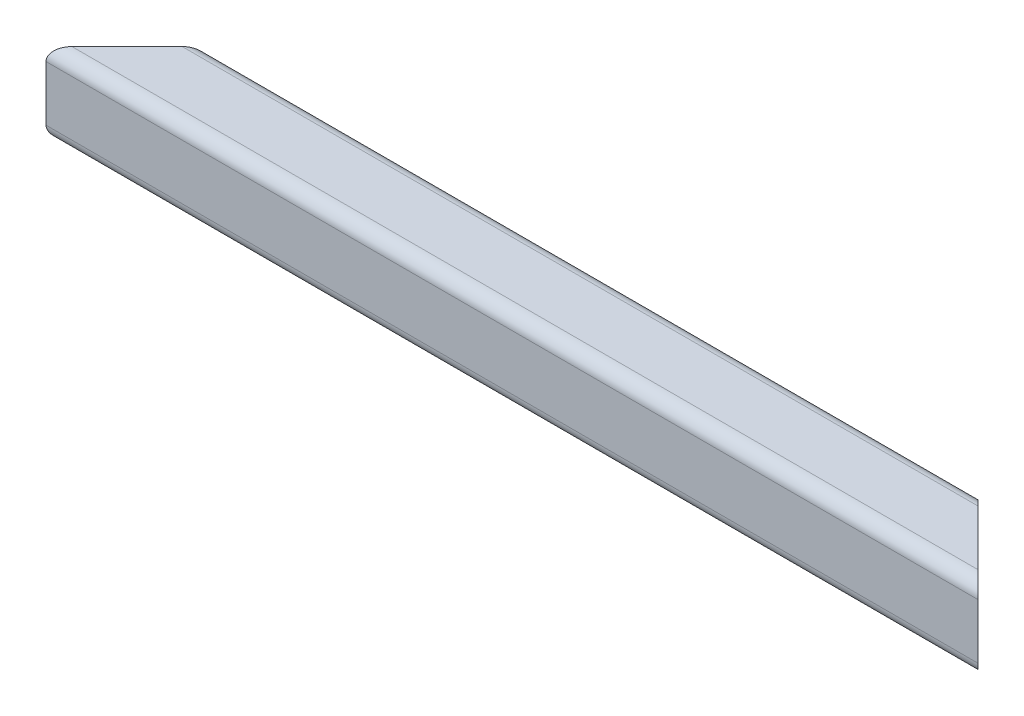
from build123d import *

# Parameters (mm, degrees)
TUBE_SQUARE_40_X_40_X_3_2_9_DEPTH = 460
CUT_EXTRUDE1_DEPTH                = 463.168800332
SKETCH15_R                        = 2
CUT_EXTRUDE4_DEPTH                = 461.868744872


with BuildPart() as part:
    # Sketch12 → Tube (square) 40 X 40 X 3.2(9) (new body)
    with BuildSketch(Plane(origin=(0, 0, 0), x_dir=(0, 0, -1), z_dir=(1, 0, 0))):
        with BuildLine():
            Line((-13.6, -20), (13.6, -20))
            ThreePointArc((13.6, -20), (18.1254834, -18.1254834), (20, -13.6))
            Line((20, -13.6), (20, 13.6))
            ThreePointArc((20, 13.6), (18.1254834, 18.1254834), (13.6, 20))
            Line((13.6, 20), (-13.6, 20))
            ThreePointArc((-13.6, 20), (-18.1254834, 18.1254834), (-20, 13.6))
            Line((-20, 13.6), (-20, -13.6))
            ThreePointArc((-20, -13.6), (-18.1254834, -18.1254834), (-13.6, -20))
        make_face()
        with BuildLine():
            Line((-13.6, -16.8), (13.6, -16.8))
            ThreePointArc((13.6, -16.8), (15.8627417, -15.8627417), (16.8, -13.6))
            Line((16.8, -13.6), (16.8, 13.6))
            ThreePointArc((16.8, 13.6), (15.8627417, 15.8627417), (13.6, 16.8))
            Line((13.6, 16.8), (-13.6, 16.8))
            ThreePointArc((-13.6, 16.8), (-15.8627417, 15.8627417), (-16.8, 13.6))
            Line((-16.8, 13.6), (-16.8, -13.6))
            ThreePointArc((-16.8, -13.6), (-15.8627417, -15.8627417), (-13.6, -16.8))
        make_face(mode=Mode.SUBTRACT)
    extrude(amount=TUBE_SQUARE_40_X_40_X_3_2_9_DEPTH)

    # Sketch13 → Cut-Extrude1 (cut, through all)
    with BuildSketch(Plane(origin=(0, 20, 0), x_dir=(1, 0, 0), z_dir=(0, 1, 0))):
        Polygon((460, 20), (460, -20), (420, 20), align=None)
        Polygon((0, 20), (0, -20), (40, 20), align=None)
    extrude(amount=-CUT_EXTRUDE1_DEPTH, mode=Mode.SUBTRACT)

    # Sketch15 → Cut-Extrude4 (cut, through all)
    with BuildSketch(Plane(origin=(0, 0, 0), x_dir=(1, 0, 0), z_dir=(0, 1, 0))):
        with Locations((440, 0)):
            Circle(SKETCH15_R)
        with Locations(Location((230, 0, 0), (0, 0, 270))):
            Circle(SKETCH15_R)
        with Locations((20, 0)):
            Circle(SKETCH15_R)
    extrude(amount=-CUT_EXTRUDE4_DEPTH, mode=Mode.SUBTRACT)


solid = part.part
